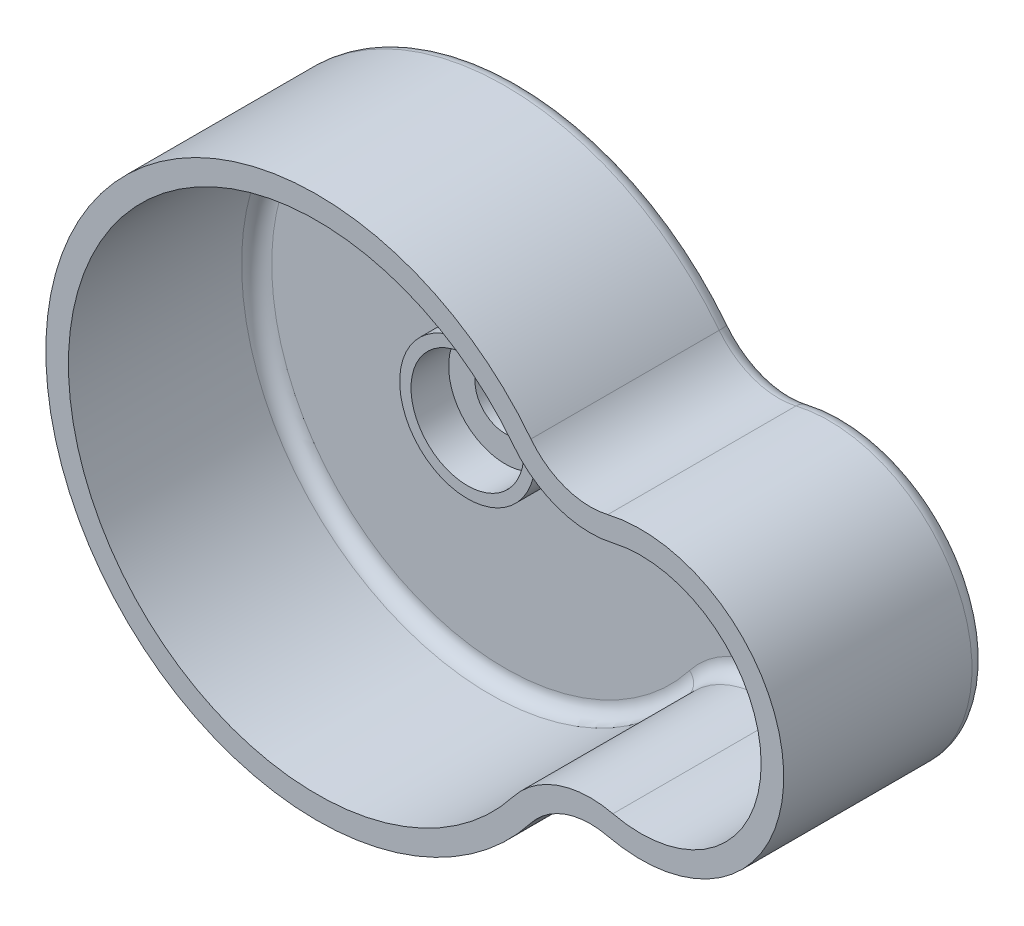
from build123d import *

# Parameters (mm, degrees)
SKETCH1_R           = 4
BOSS_EXTRUDE1_DEPTH = 2
SKETCH1_3_R         = 9
SKETCH1_3_R_2       = 7.5
BOSS_EXTRUDE2_DEPTH = 7
BOSS_EXTRUDE3_DEPTH = 27
FILLET1_R           = 2


with BuildPart() as part:
    # Sketch1 → Boss-Extrude1 (new body)
    with BuildSketch(Plane.XY):
        with BuildLine():
            ThreePointArc((38.627105052, 18.489937528), (32.999839448, 18.790712656), (28.428715875, 22.086378465))
            ThreePointArc((28.428715875, 22.086378465), (-36, 0), (28.428715875, -22.086378465))
            ThreePointArc((28.428715875, -22.086378465), (32.999839448, -18.790712656), (38.627105052, -18.489937528))
            ThreePointArc((38.627105052, -18.489937528), (62, 0), (38.627105052, 18.489937528))
        make_face()
        Circle(SKETCH1_R, mode=Mode.SUBTRACT)
        with Locations((43, 0)):
            Circle(SKETCH1_R, mode=Mode.SUBTRACT)
    extrude(amount=BOSS_EXTRUDE1_DEPTH)

    # Sketch1<3> → Boss-Extrude2 (add)
    # profile 1 of 2: a face of its own
    with BuildSketch(Plane.XY):
        Circle(SKETCH1_3_R)
        Circle(SKETCH1_3_R_2, mode=Mode.SUBTRACT)
    # profile 2 of 2: a face of its own
    with BuildSketch(Plane.XY):
        with Locations((43, 0)):
            Circle(SKETCH1_3_R)
        with Locations((43, 0)):
            Circle(SKETCH1_3_R_2, mode=Mode.SUBTRACT)
    extrude(amount=BOSS_EXTRUDE2_DEPTH)

    # Sketch1<4> → Boss-Extrude3 (add)
    with BuildSketch(Plane.XY):
        with BuildLine():
            ThreePointArc((38.627105052, 18.489937528), (32.999839448, 18.790712656), (28.428715875, 22.086378465))
            ThreePointArc((28.428715875, 22.086378465), (-36, 0), (28.428715875, -22.086378465))
            ThreePointArc((28.428715875, -22.086378465), (32.999839448, -18.790712656), (38.627105052, -18.489937528))
            ThreePointArc((38.627105052, -18.489937528), (62, 0), (38.627105052, 18.489937528))
        make_face()
        with BuildLine():
            ThreePointArc((26.059656218, -20.245846927), (-33, 0), (26.059656218, 20.245846927))
            ThreePointArc((26.059656218, 20.245846927), (32.002116864, 15.961481374), (39.317562149, 15.570473707))
            ThreePointArc((39.317562149, 15.570473707), (59, 0), (39.317562149, -15.570473707))
            ThreePointArc((39.317562149, -15.570473707), (32.002116864, -15.961481374), (26.059656218, -20.245846927))
        make_face(mode=Mode.SUBTRACT)
    extrude(amount=BOSS_EXTRUDE3_DEPTH)

    # Fillet1
    fillet1_edges = [part.edges().sort_by_distance(p)[0] for p in [
        (32.999839448, -18.790712656, 0),
        (-36, 0, 0),
        (32.999839448, 18.790712656, 0),
        (32.002116864, -15.961481374, 2),
        (59, 0, 2),
        (32.002116864, 15.961481374, 2),
        (62, 0, 0),
        (-33, 0, 2),
    ]]
    fillet(fillet1_edges, radius=FILLET1_R)


solid = part.part
